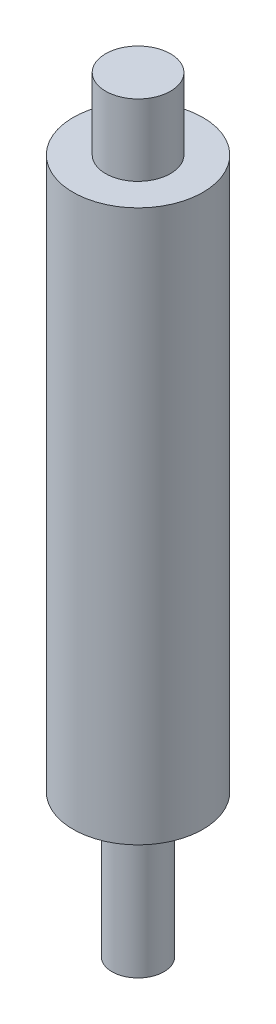
from build123d import *


with BuildPart() as part:
    # Croquis1 → Revolución1 (revolve)
    with BuildSketch(Plane.XY, mode=Mode.PRIVATE) as revoluci_n1_sk:
        Polygon((0, 0), (0, 118), (-5, 118), (-5, 107), (-10, 107), (-10, 22), (-4, 22), (-4, 0), align=None)
    revolve(revoluci_n1_sk.sketch.rotate(Axis((0, 0, 0), (0, 1, 0)), 270), axis=Axis((0, 0, 0), (0, 1, 0)))


solid = part.part
